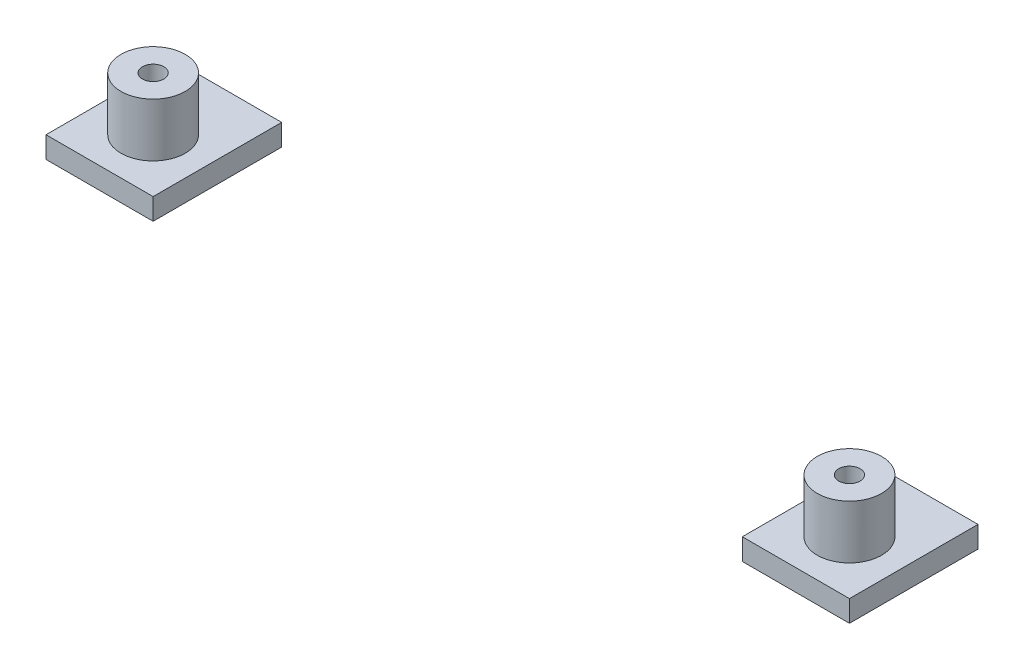
from build123d import *

# Parameters (mm, degrees)
SKETCH1_W           = 75
SKETCH1_H           = 2
BOSS_EXTRUDE1_DEPTH = 10
SKETCH2_R           = 3
SKETCH2_R_2         = 1
BOSS_EXTRUDE2_DEPTH = 5
SKETCH3_R           = 1
CUT_EXTRUDE1_DEPTH  = 40.131189606
SKETCH4_W           = 55
SKETCH4_H           = 10
CUT_EXTRUDE2_DEPTH  = 10
SKETCH5_W           = 10
SKETCH5_H           = 2
BOSS_EXTRUDE3_DEPTH = 2
SKETCH6_W           = 10
SKETCH6_H           = 2
BOSS_EXTRUDE4_DEPTH = 2


with BuildPart() as part:
    # Sketch1 → Boss-Extrude1 (new body)
    with BuildSketch(Plane.XY):
        with Locations((0, 1)):
            Rectangle(SKETCH1_W, SKETCH1_H)
    extrude(amount=BOSS_EXTRUDE1_DEPTH)

    # Sketch2 → Boss-Extrude2 (add)
    # profile 1 of 2: a face of its own
    with BuildSketch(Plane(origin=(0, 2, 0), x_dir=(1, 0, 0), z_dir=(0, 1, 0))):
        with Locations(Location((32.5, -5, 0), (0, 0, 90))):
            Circle(SKETCH2_R)
        with Locations(Location((32.5, -5, 0), (0, 0, 270))):
            Circle(SKETCH2_R_2, mode=Mode.SUBTRACT)
    # profile 2 of 2: a face of its own
    with BuildSketch(Plane(origin=(0, 2, 0), x_dir=(1, 0, 0), z_dir=(0, 1, 0))):
        with Locations(Location((-32.5, -5, 0), (0, 0, 90))):
            Circle(SKETCH2_R)
        with Locations(Location((-32.5, -5, 0), (0, 0, 90))):
            Circle(SKETCH2_R_2, mode=Mode.SUBTRACT)
    extrude(amount=BOSS_EXTRUDE2_DEPTH)

    # Sketch3 → Cut-Extrude1 (cut, through all)
    with BuildSketch(Plane(origin=(0, 2, 0), x_dir=(1, 0, 0), z_dir=(0, 1, 0))):
        with Locations(Location((32.5, -5, 0), (0, 0, 270))):
            Circle(SKETCH3_R)
        with Locations(Location((-32.5, -5, 0), (0, 0, 90))):
            Circle(SKETCH3_R)
    extrude(amount=-CUT_EXTRUDE1_DEPTH, mode=Mode.SUBTRACT)

    # Sketch4 → Cut-Extrude2 (cut)
    with BuildSketch(Plane(origin=(0, 2, 0), x_dir=(1, 0, 0), z_dir=(0, 1, 0))):
        with Locations((0, -5)):
            Rectangle(SKETCH4_W, SKETCH4_H)
    extrude(amount=-CUT_EXTRUDE2_DEPTH, mode=Mode.SUBTRACT)


with BuildPart() as cut_extrude2_piece_1:
    # of the separate pieces the step leaves, piece 1, a body of its own (cut_extrude2_pieces)
    add(part.part.solids().sort_by_distance((27.5, 0, 0))[0])

    # Sketch5 → Boss-Extrude3 (add)
    with BuildSketch(Plane(origin=(0, 0, 0), x_dir=(-1, 0, 0), z_dir=(0, 0, -1))):
        with Locations((-32.5, 1)):
            Rectangle(SKETCH5_W, SKETCH5_H)
    extrude(amount=BOSS_EXTRUDE3_DEPTH)


with BuildPart() as cut_extrude2_piece_2:
    # of the separate pieces the step leaves, piece 2, a body of its own (cut_extrude2_pieces)
    add(part.part.solids().sort_by_distance((-37.5, 0, 0))[0])

    # Sketch6 → Boss-Extrude4 (add)
    with BuildSketch(Plane(origin=(0, 0, 0), x_dir=(-1, 0, 0), z_dir=(0, 0, -1))):
        with Locations((32.5, 1)):
            Rectangle(SKETCH6_W, SKETCH6_H)
    extrude(amount=BOSS_EXTRUDE4_DEPTH)


solid = Compound([cut_extrude2_piece_1.part, cut_extrude2_piece_2.part])
